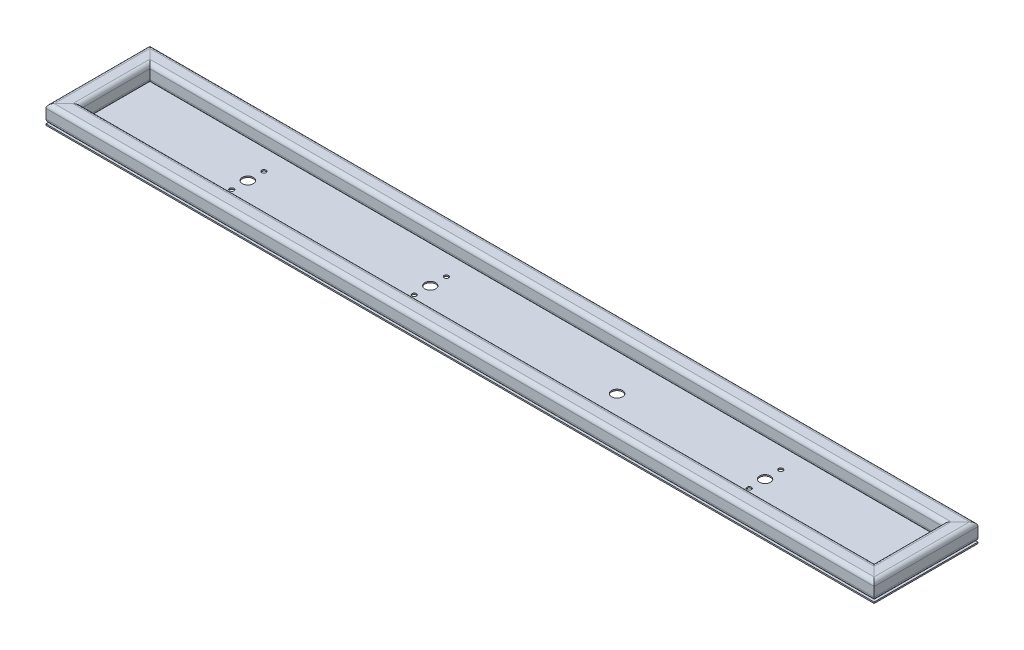
from build123d import *

# Parameters (mm, degrees)
TUBO_CUADRADO_2_X_2_X_0_25_1_DEPTH      = 186.921024484
TUBO_CUADRADO_2_X_2_X_0_25_1_DEPTH_BACK = 36.921024484
TUBO_CUADRADO_2_X_2_X_0_25_1_2_DEPTH    = 1270.242048969
TUBO_CUADRADO_2_X_2_X_0_25_1_3_DEPTH    = 223.842048969
TUBO_CUADRADO_2_X_2_X_0_25_1_4_DEPTH    = 1270.242048969
CROQUIS3_W                              = 1196.4
CROQUIS3_H                              = 150
SALIENTE_EXTRUIR1_DEPTH                 = 1.9
CROQUIS4_R                              = 3.175
CROQUIS4_R_2                            = 7.9375
CROQUIS4_R_3                            = 7.839550791
CORTAR_EXTRUIR1_DEPTH                   = 63.5


with BuildPart() as part:
    # Sketch1 → Tubo cuadrado 2 X 2 X 0.25(1) (new, two sides: drawn at the far end of the back side and taken through both)
    with BuildSketch(Plane(origin=(-585.5, 12.7, -75), x_dir=(1, 0, 0), z_dir=(0, 0, 1)).offset(-TUBO_CUADRADO_2_X_2_X_0_25_1_DEPTH_BACK)):
        with BuildLine():
            Line((-6.7, -12.7), (6.7, -12.7))
            ThreePointArc((6.7, -12.7), (10.942640687, -10.942640687), (12.7, -6.7))
            Line((12.7, -6.7), (12.7, 6.7))
            ThreePointArc((12.7, 6.7), (10.942640687, 10.942640687), (6.7, 12.7))
            Line((6.7, 12.7), (-6.7, 12.7))
            ThreePointArc((-6.7, 12.7), (-10.942640687, 10.942640687), (-12.7, 6.7))
            Line((-12.7, 6.7), (-12.7, -6.7))
            ThreePointArc((-12.7, -6.7), (-10.942640687, -10.942640687), (-6.7, -12.7))
        make_face()
        with BuildLine():
            Line((-6.7, -9.7), (6.7, -9.7))
            ThreePointArc((6.7, -9.7), (8.821320344, -8.821320344), (9.7, -6.7))
            Line((9.7, -6.7), (9.7, 6.7))
            ThreePointArc((9.7, 6.7), (8.821320344, 8.821320344), (6.7, 9.7))
            Line((6.7, 9.7), (-6.7, 9.7))
            ThreePointArc((-6.7, 9.7), (-8.821320344, 8.821320344), (-9.7, 6.7))
            Line((-9.7, 6.7), (-9.7, -6.7))
            ThreePointArc((-9.7, -6.7), (-8.821320344, -8.821320344), (-6.7, -9.7))
        make_face(mode=Mode.SUBTRACT)
    extrude(amount=TUBO_CUADRADO_2_X_2_X_0_25_1_DEPTH + TUBO_CUADRADO_2_X_2_X_0_25_1_DEPTH_BACK)

    # Tubo cuadrado 2 X 2 X 0.25(1) mitre 1
    split(bisect_by=Plane(origin=(-598.2, 0, -75), x_dir=(0, -1, 0), z_dir=(-0.707106781, 0, 0.707106781)), keep=Keep.TOP)

    # Tubo cuadrado 2 X 2 X 0.25(1) mitre 2
    split(bisect_by=Plane(origin=(-598.2, 0, 75), x_dir=(0, -1, 0), z_dir=(-0.707106781, 0, -0.707106781)), keep=Keep.TOP)


with BuildPart() as body_2:
    # Sketch1 on segment 2 (carried to segment 2) → Tubo cuadrado 2 X 2 X 0.25_1 2 (new body)
    with BuildSketch(Plane(origin=(-635.121024484, 12.7, 62.3), x_dir=(0, 0, -1), z_dir=(1, 0, 0))):
        with BuildLine():
            Line((-6.7, -12.7), (6.7, -12.7))
            ThreePointArc((6.7, -12.7), (10.942640687, -10.942640687), (12.7, -6.7))
            Line((12.7, -6.7), (12.7, 6.7))
            ThreePointArc((12.7, 6.7), (10.942640687, 10.942640687), (6.7, 12.7))
            Line((6.7, 12.7), (-6.7, 12.7))
            ThreePointArc((-6.7, 12.7), (-10.942640687, 10.942640687), (-12.7, 6.7))
            Line((-12.7, 6.7), (-12.7, -6.7))
            ThreePointArc((-12.7, -6.7), (-10.942640687, -10.942640687), (-6.7, -12.7))
        make_face()
        with BuildLine():
            Line((-6.7, -9.7), (6.7, -9.7))
            ThreePointArc((6.7, -9.7), (8.821320344, -8.821320344), (9.7, -6.7))
            Line((9.7, -6.7), (9.7, 6.7))
            ThreePointArc((9.7, 6.7), (8.821320344, 8.821320344), (6.7, 9.7))
            Line((6.7, 9.7), (-6.7, 9.7))
            ThreePointArc((-6.7, 9.7), (-8.821320344, 8.821320344), (-9.7, 6.7))
            Line((-9.7, 6.7), (-9.7, -6.7))
            ThreePointArc((-9.7, -6.7), (-8.821320344, -8.821320344), (-6.7, -9.7))
        make_face(mode=Mode.SUBTRACT)
    extrude(amount=TUBO_CUADRADO_2_X_2_X_0_25_1_2_DEPTH)

    # Tubo cuadrado 2 X 2 X 0.25_1 2 mitre 1
    split(bisect_by=Plane(origin=(-598.2, 0, 75), x_dir=(0, 1, 0), z_dir=(0.707106781, 0, 0.707106781)), keep=Keep.TOP)

    # Tubo cuadrado 2 X 2 X 0.25_1 2 mitre 2
    split(bisect_by=Plane(origin=(598.2, 0, 75), x_dir=(0, -1, 0), z_dir=(-0.707106781, 0, 0.707106781)), keep=Keep.TOP)


with BuildPart() as body_3:
    # Sketch1 on segment 3 (carried to segment 3) → Tubo cuadrado 2 X 2 X 0.25_1 3 (new body)
    with BuildSketch(Plane(origin=(585.5, 12.7, 111.921024484), x_dir=(-1, 0, 0), z_dir=(0, 0, -1))):
        with BuildLine():
            Line((-6.7, -12.7), (6.7, -12.7))
            ThreePointArc((6.7, -12.7), (10.942640687, -10.942640687), (12.7, -6.7))
            Line((12.7, -6.7), (12.7, 6.7))
            ThreePointArc((12.7, 6.7), (10.942640687, 10.942640687), (6.7, 12.7))
            Line((6.7, 12.7), (-6.7, 12.7))
            ThreePointArc((-6.7, 12.7), (-10.942640687, 10.942640687), (-12.7, 6.7))
            Line((-12.7, 6.7), (-12.7, -6.7))
            ThreePointArc((-12.7, -6.7), (-10.942640687, -10.942640687), (-6.7, -12.7))
        make_face()
        with BuildLine():
            Line((-6.7, -9.7), (6.7, -9.7))
            ThreePointArc((6.7, -9.7), (8.821320344, -8.821320344), (9.7, -6.7))
            Line((9.7, -6.7), (9.7, 6.7))
            ThreePointArc((9.7, 6.7), (8.821320344, 8.821320344), (6.7, 9.7))
            Line((6.7, 9.7), (-6.7, 9.7))
            ThreePointArc((-6.7, 9.7), (-8.821320344, 8.821320344), (-9.7, 6.7))
            Line((-9.7, 6.7), (-9.7, -6.7))
            ThreePointArc((-9.7, -6.7), (-8.821320344, -8.821320344), (-6.7, -9.7))
        make_face(mode=Mode.SUBTRACT)
    extrude(amount=TUBO_CUADRADO_2_X_2_X_0_25_1_3_DEPTH)

    # Tubo cuadrado 2 X 2 X 0.25_1 3 mitre 1
    split(bisect_by=Plane(origin=(598.2, 0, -75), x_dir=(0, 1, 0), z_dir=(0.707106781, 0, 0.707106781)), keep=Keep.TOP)

    # Tubo cuadrado 2 X 2 X 0.25_1 3 mitre 2
    split(bisect_by=Plane(origin=(598.2, 0, 75), x_dir=(0, 1, 0), z_dir=(0.707106781, 0, -0.707106781)), keep=Keep.TOP)


with BuildPart() as body_4:
    # Sketch1 on segment 4 (carried to segment 4) → Tubo cuadrado 2 X 2 X 0.25_1 4 (new body)
    with BuildSketch(Plane(origin=(635.121024484, 12.7, -62.3), x_dir=(0, 0, 1), z_dir=(-1, 0, 0))):
        with BuildLine():
            Line((-6.7, -12.7), (6.7, -12.7))
            ThreePointArc((6.7, -12.7), (10.942640687, -10.942640687), (12.7, -6.7))
            Line((12.7, -6.7), (12.7, 6.7))
            ThreePointArc((12.7, 6.7), (10.942640687, 10.942640687), (6.7, 12.7))
            Line((6.7, 12.7), (-6.7, 12.7))
            ThreePointArc((-6.7, 12.7), (-10.942640687, 10.942640687), (-12.7, 6.7))
            Line((-12.7, 6.7), (-12.7, -6.7))
            ThreePointArc((-12.7, -6.7), (-10.942640687, -10.942640687), (-6.7, -12.7))
        make_face()
        with BuildLine():
            Line((-6.7, -9.7), (6.7, -9.7))
            ThreePointArc((6.7, -9.7), (8.821320344, -8.821320344), (9.7, -6.7))
            Line((9.7, -6.7), (9.7, 6.7))
            ThreePointArc((9.7, 6.7), (8.821320344, 8.821320344), (6.7, 9.7))
            Line((6.7, 9.7), (-6.7, 9.7))
            ThreePointArc((-6.7, 9.7), (-8.821320344, 8.821320344), (-9.7, 6.7))
            Line((-9.7, 6.7), (-9.7, -6.7))
            ThreePointArc((-9.7, -6.7), (-8.821320344, -8.821320344), (-6.7, -9.7))
        make_face(mode=Mode.SUBTRACT)
    extrude(amount=TUBO_CUADRADO_2_X_2_X_0_25_1_4_DEPTH)

    # Tubo cuadrado 2 X 2 X 0.25_1 4 mitre 1
    split(bisect_by=Plane(origin=(-598.2, 0, -75), x_dir=(0, 1, 0), z_dir=(0.707106781, 0, -0.707106781)), keep=Keep.TOP)

    # Tubo cuadrado 2 X 2 X 0.25_1 4 mitre 2
    split(bisect_by=Plane(origin=(598.2, 0, -75), x_dir=(0, -1, 0), z_dir=(-0.707106781, 0, -0.707106781)), keep=Keep.TOP)


with BuildPart() as body_5:
    # Croquis3 → Saliente-Extruir1 (new body)
    with BuildSketch(Plane.XZ):
        Rectangle(CROQUIS3_W, CROQUIS3_H)
    extrude(amount=SALIENTE_EXTRUIR1_DEPTH)

    # Croquis4 → Cortar-Extruir1 (cut)
    with BuildSketch(Plane(origin=(0, 0, 0), x_dir=(1, 0, 0), z_dir=(0, 1, 0))):
        with Locations(Location((-381.328059978, 23, 0), (0, 0, 180))):
            Circle(CROQUIS4_R)
        with Locations(Location((-381.572933, 0, 0), (0, 0, 180))):
            Circle(CROQUIS4_R_2)
        with Locations(Location((-381.817806022, -23, 0), (0, 0, 180))):
            Circle(CROQUIS4_R)
        with Locations(Location((-118.072933, 0, 0), (0, 0, 180))):
            Circle(CROQUIS4_R_3)
        with Locations(Location((-117.828059978, 23, 0), (0, 0, 180))):
            Circle(CROQUIS4_R)
        with Locations(Location((-118.317806022, -23, 0), (0, 0, 180))):
            Circle(CROQUIS4_R)
        with Locations(Location((151.785097887, 0, 0), (0, 0, 180))):
            Circle(CROQUIS4_R_2)
        with Locations(Location((365.507795334, 0, 0), (0, 0, 180))):
            Circle(CROQUIS4_R_2)
        with Locations(Location((365.262922313, 23, 0), (0, 0, 180))):
            Circle(CROQUIS4_R)
        with Locations(Location((365.752668356, -23, 0), (0, 0, 180))):
            Circle(CROQUIS4_R)
    extrude(amount=-CORTAR_EXTRUIR1_DEPTH, mode=Mode.SUBTRACT)


solid = Compound([part.part, body_2.part, body_3.part, body_4.part, body_5.part])
